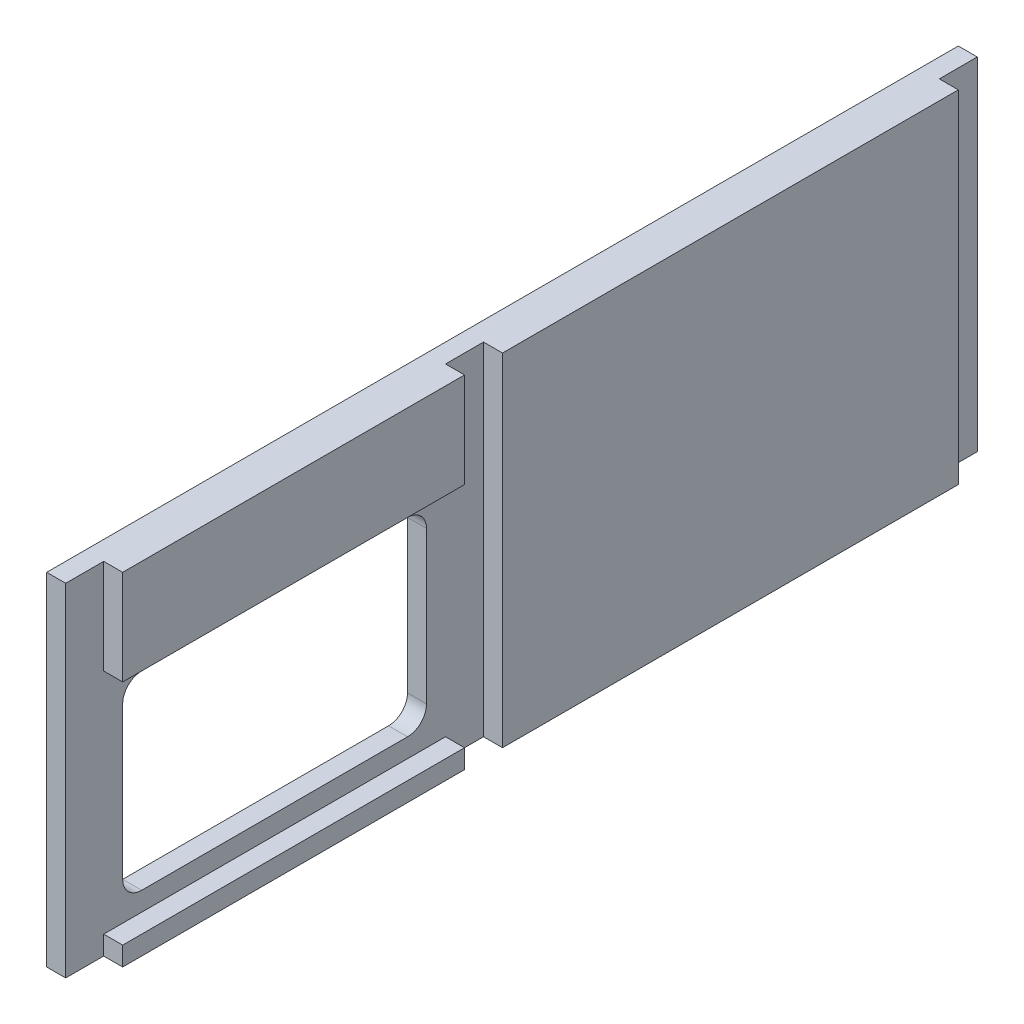
from build123d import *

# Parameters (mm, degrees)
SKETCH1_W           = 304.8
SKETCH1_H           = 114.3
BOSS_EXTRUDE1_DEPTH = 12.7
SKETCH2_W           = 12.7
SKETCH2_H           = 114.3
CUT_EXTRUDE1_DEPTH  = 6.35
SKETCH3_W           = 114.3
SKETCH3_H           = 76.2
CUT_EXTRUDE2_DEPTH  = 6.35
CUT_EXTRUDE3_DEPTH  = 326.58847108


with BuildPart() as part:
    # Sketch1 → Boss-Extrude1 (new body)
    with BuildSketch(Plane(origin=(0, 0, 0), x_dir=(0, 0, -1), z_dir=(1, 0, 0))):
        with Locations((152.4, 57.15)):
            Rectangle(SKETCH1_W, SKETCH1_H)
    extrude(amount=BOSS_EXTRUDE1_DEPTH)

    # Sketch2 → Cut-Extrude1 (cut)
    with BuildSketch(Plane(origin=(12.7, 0, 0), x_dir=(0, 0, -1), z_dir=(1, 0, 0))):
        with Locations((6.35, 57.15)):
            Rectangle(SKETCH2_W, SKETCH2_H)
        with Locations((298.45, 57.15)):
            Rectangle(SKETCH2_W, SKETCH2_H)
        with Locations((133.35, 57.15)):
            Rectangle(SKETCH2_W, SKETCH2_H)
    extrude(amount=-CUT_EXTRUDE1_DEPTH, mode=Mode.SUBTRACT)

    # Sketch3 → Cut-Extrude2 (cut)
    with BuildSketch(Plane(origin=(12.7, 0, 0), x_dir=(0, 0, -1), z_dir=(1, 0, 0))):
        with Locations((69.85, 44.45)):
            Rectangle(SKETCH3_W, SKETCH3_H)
    extrude(amount=-CUT_EXTRUDE2_DEPTH, mode=Mode.SUBTRACT)

    # Sketch4 → Cut-Extrude3 (cut, through all)
    with BuildSketch(Plane(origin=(6.35, 0, 0), x_dir=(0, 0, -1), z_dir=(1, 0, 0))):
        with BuildLine():
            Line((19.05, 69.85), (19.05, 19.05))
            ThreePointArc((19.05, 19.05), (20.909871939, 14.559871939), (25.4, 12.7))
            Line((25.4, 12.7), (114.3, 12.7))
            ThreePointArc((114.3, 12.7), (118.790128061, 14.559871939), (120.65, 19.05))
            Line((120.65, 19.05), (120.65, 69.85))
            ThreePointArc((120.65, 69.85), (118.790128061, 74.340128061), (114.3, 76.2))
            Line((114.3, 76.2), (25.4, 76.2))
            ThreePointArc((25.4, 76.2), (20.909871939, 74.340128061), (19.05, 69.85))
        make_face()
    extrude(amount=-CUT_EXTRUDE3_DEPTH, mode=Mode.SUBTRACT)


solid = part.part
